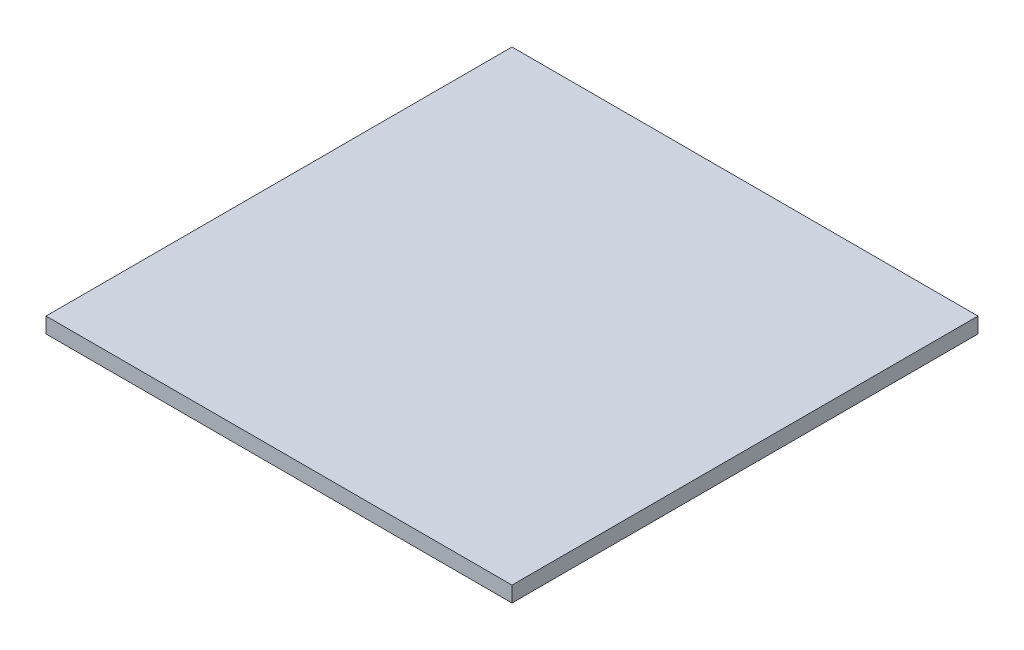
from build123d import *

# Parameters (mm, degrees)
CROQUIS1_W              = 30
CROQUIS1_H              = 30
SALIENTE_EXTRUIR1_DEPTH = 1


with BuildPart() as part:
    # Croquis1 → Saliente-Extruir1 (new body)
    with BuildSketch(Plane(origin=(0, 0, 0), x_dir=(1, 0, 0), z_dir=(0, 1, 0))):
        with Locations((15, 15)):
            Rectangle(CROQUIS1_W, CROQUIS1_H)
    extrude(amount=SALIENTE_EXTRUIR1_DEPTH)


solid = part.part
